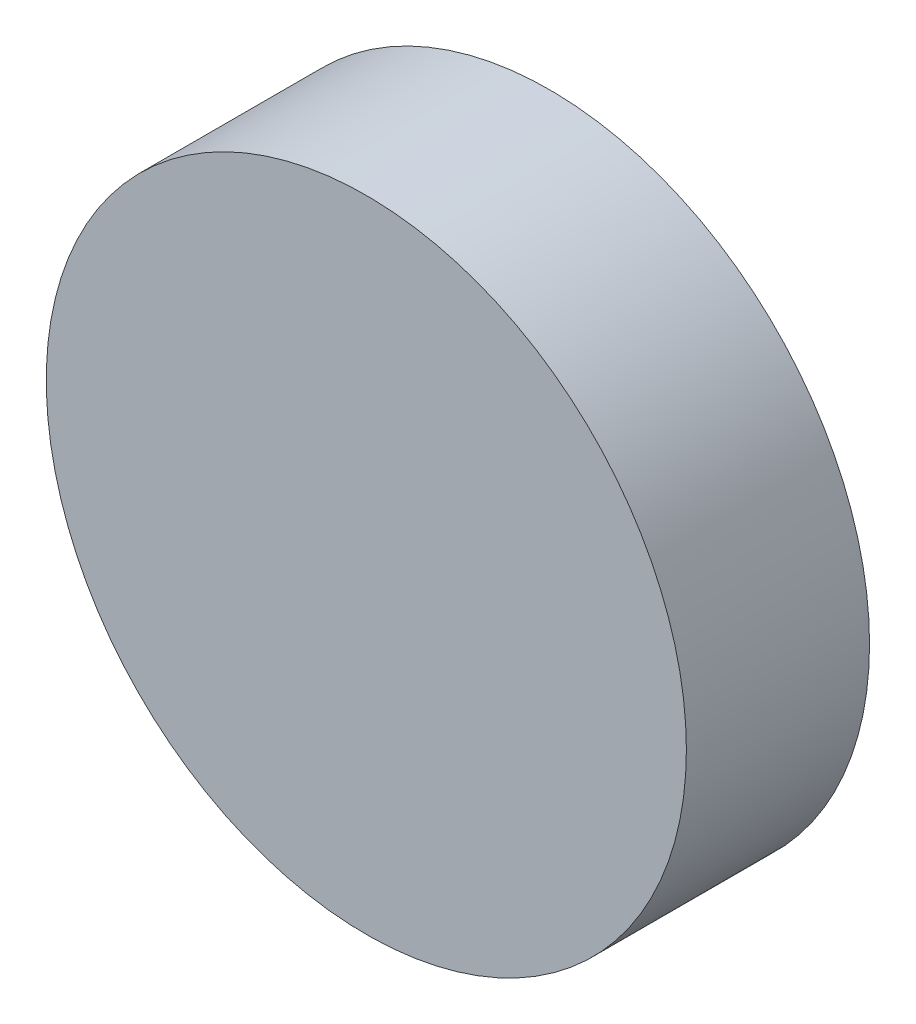
from build123d import *

# Parameters (mm, degrees)
SKETCH1_R           = 10.714459944
BOSS_EXTRUDE1_DEPTH = 6.131443554


with BuildPart() as part:
    # Sketch1 → Boss-Extrude1 (new body)
    with BuildSketch(Plane.XY):
        Circle(SKETCH1_R)
    extrude(amount=BOSS_EXTRUDE1_DEPTH)


solid = part.part
